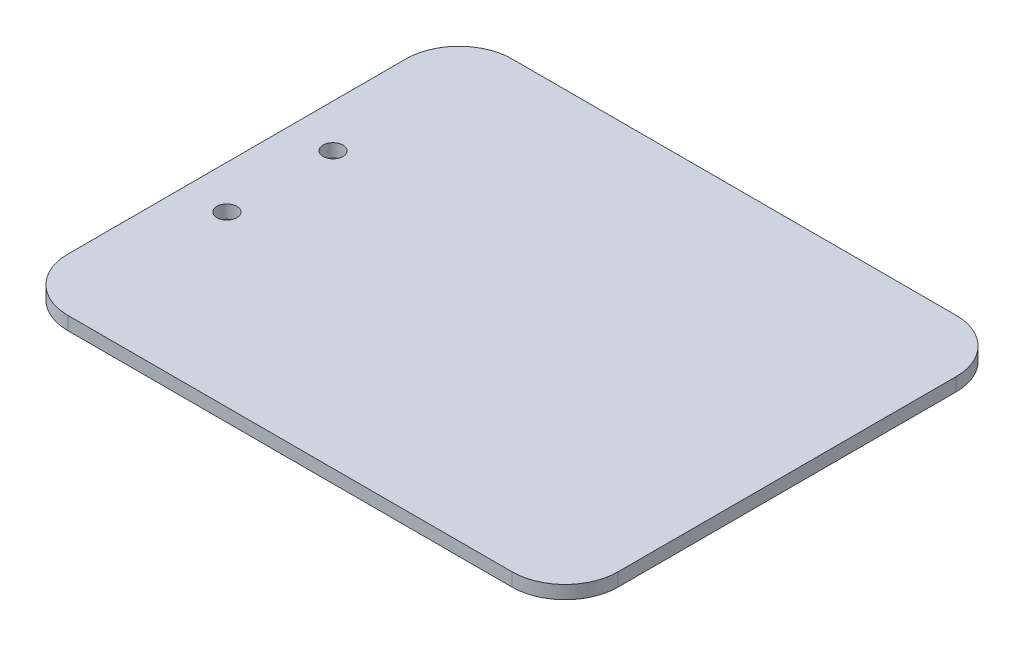
from build123d import *

# Parameters (mm, degrees)
SKETCH1_R           = 1.5
BOSS_EXTRUDE1_DEPTH = 2


with BuildPart() as part:
    # Sketch1 → Boss-Extrude1 (new body)
    with BuildSketch(Plane(origin=(0, 0, 0), x_dir=(1, 0, 0), z_dir=(0, 1, 0))):
        with BuildLine():
            Line((8, 0), (75, 0))
            ThreePointArc((75, 0), (80.656854249, 2.343145751), (83, 8))
            Line((83, 8), (83, 59))
            ThreePointArc((83, 59), (80.656854249, 64.656854249), (75, 67))
            Line((75, 67), (8, 67))
            ThreePointArc((8, 67), (2.343145751, 64.656854249), (0, 59))
            Line((0, 59), (0, 8))
            ThreePointArc((0, 8), (2.343145751, 2.343145751), (8, 0))
        make_face()
        with Locations(Location((6.5, 41.5, 0), (0, 0, 270))):
            Circle(SKETCH1_R, mode=Mode.SUBTRACT)
        with Locations(Location((6.5, 25.5, 0), (0, 0, 90))):
            Circle(SKETCH1_R, mode=Mode.SUBTRACT)
    extrude(amount=BOSS_EXTRUDE1_DEPTH)


solid = part.part
